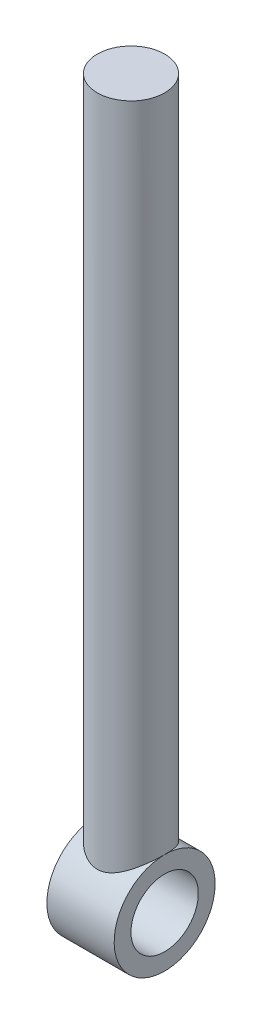
from build123d import *

# Parameters (mm, degrees)
SKETCH1_W = 5
SKETCH1_H = 100
SKETCH3_W = 10
SKETCH3_H = 2.5


with BuildPart() as part:
    # Sketch1 → Revolve1 (revolve)
    with BuildSketch(Plane.XY, mode=Mode.PRIVATE) as revolve1_sk:
        with Locations((1.128691983, -44.251054852)):
            Rectangle(SKETCH1_W, SKETCH1_H)
    revolve(revolve1_sk.sketch.rotate(Axis((-1.371308017, 5.748945148, 0), (0, -1, 0)), 180), axis=Axis((-1.371308017, 5.748945148, 0), (0, -1, 0)))

    # Sketch3 → Revolve2 (revolve)
    with BuildSketch(Plane.XY, mode=Mode.PRIVATE) as revolve2_sk:
        with Locations((-1.371308017, -93.501054852)):
            Rectangle(SKETCH3_W, SKETCH3_H)
    revolve(revolve2_sk.sketch.rotate(Axis((-6.825803424, -99.751054852, 0), (1, 0, 0)), 90), axis=Axis((-6.825803424, -99.751054852, 0), (1, 0, 0)))


solid = part.part
